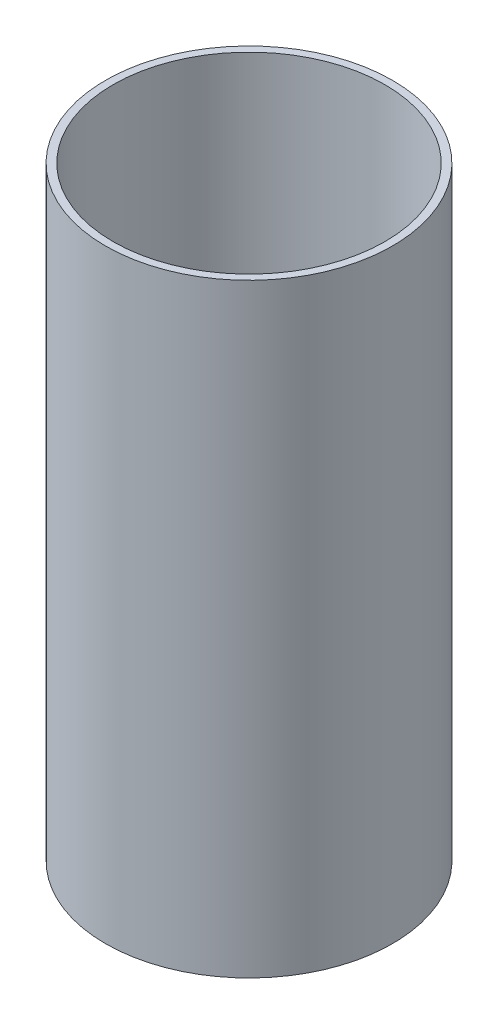
from build123d import *

# Parameters (mm, degrees)
SKETCH2_R           = 38
SKETCH2_R_2         = 36
BOSS_EXTRUDE1_DEPTH = 160


with BuildPart() as part:
    # Sketch2 → Boss-Extrude1 (new body)
    with BuildSketch(Plane(origin=(0, 0, 0), x_dir=(1, 0, 0), z_dir=(0, 1, 0))):
        with Locations(Location((0, 0, 0), (0, 0, 270))):
            Circle(SKETCH2_R)
        with Locations(Location((0, 0, 0), (0, 0, 270))):
            Circle(SKETCH2_R_2, mode=Mode.SUBTRACT)
    extrude(amount=BOSS_EXTRUDE1_DEPTH)


solid = part.part
